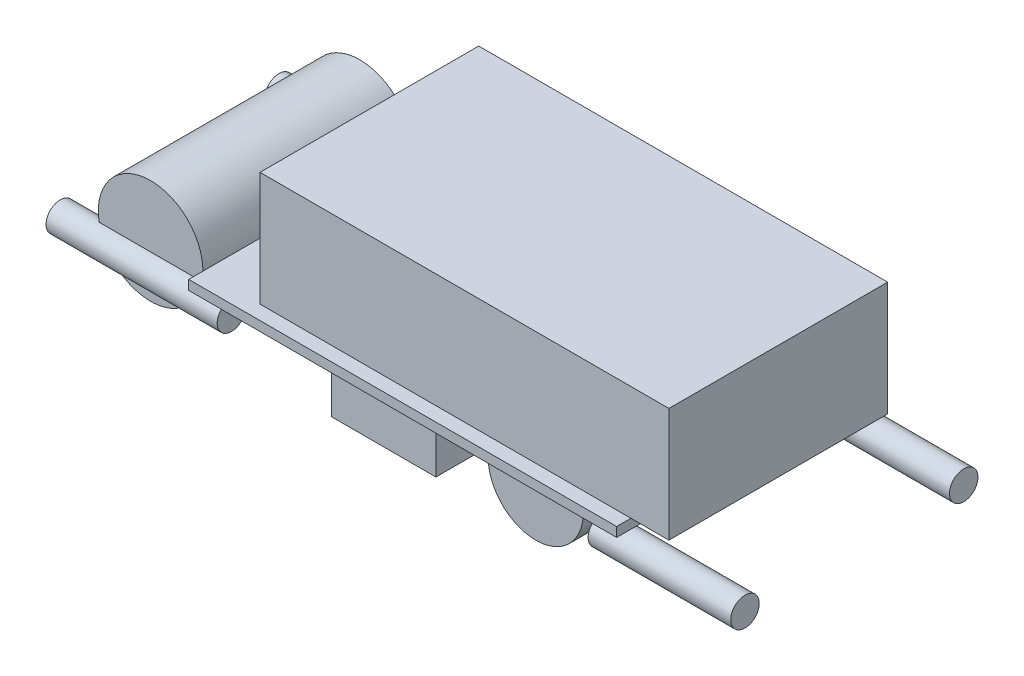
from build123d import *

# Parameters (mm, degrees)
CROQUIS1_W                     = 43
CROQUIS1_H                     = 23
SALIENTE_EXTRUIR1_DEPTH        = 12
CROQUIS2_W                     = 45
CROQUIS2_H                     = 26
SALIENTE_EXTRUIR2_DEPTH        = 1
CROQUIS4_R                     = 5.5
SALIENTE_EXTRUIR3_DEPTH        = 22
SALIENTE_EXTRUIR4_DEPTH        = 5
SALIENTE_EXTRUIR5_START        = -6
CROQUIS7_R                     = 5
SALIENTE_EXTRUIR5_DEPTH        = 13
SALIENTE_EXTRUIR6_DEPTH        = 12
SALIENTE_EXTRUIR6_DEPTH_BACK   = 3
CROQUIS8_R                     = 1.5
SALIENTE_EXTRUIR6_2_DEPTH      = 12
SALIENTE_EXTRUIR6_2_DEPTH_BACK = 3
SALIENTE_EXTRUIR7_DEPTH        = 15
SALIENTE_EXTRUIR7_DEPTH_BACK   = 3
CROQUIS9_R                     = 1.5


with BuildPart() as part:
    # Croquis1 → Saliente-Extruir1 (new body)
    with BuildSketch(Plane(origin=(0, 0, 0), x_dir=(1, 0, 0), z_dir=(0, 1, 0))):
        with Locations((21.5, 11.5)):
            Rectangle(CROQUIS1_W, CROQUIS1_H)
    extrude(amount=SALIENTE_EXTRUIR1_DEPTH)

    # Croquis2 → Saliente-Extruir2 (add)
    with BuildSketch(Plane.XZ):
        with Locations((16.5, -11.5)):
            Rectangle(CROQUIS2_W, CROQUIS2_H)
    extrude(amount=SALIENTE_EXTRUIR2_DEPTH)

    # Croquis6 → Saliente-Extruir4 (add)
    with BuildSketch(Plane.XZ.offset(1)):
        Polygon((8, 0.5), (19, 0.5), (19, -23.5), (5, -23.5), (5, -11.5), (8, -11.5), align=None)
    extrude(amount=SALIENTE_EXTRUIR4_DEPTH)


with BuildPart() as body_2:
    # Croquis4 → Saliente-Extruir3 (new body)
    with BuildSketch(Plane.XY):
        with Locations((-11.5, 0)):
            Circle(CROQUIS4_R)
    extrude(amount=-SALIENTE_EXTRUIR3_DEPTH)

    # Croquis9 → Saliente-Extruir7 (add, two sides: drawn at the far end of the back side and taken through both)
    with BuildSketch(Plane.ZY.offset(6).offset(-SALIENTE_EXTRUIR7_DEPTH_BACK)):
        with Locations(Location((-23, -2.5, 0), (0, 0, 180))):
            Circle(CROQUIS9_R)
        with Locations(Location((0, -2.5, 0), (0, 0, 180))):
            Circle(CROQUIS9_R)
    extrude(amount=SALIENTE_EXTRUIR7_DEPTH + SALIENTE_EXTRUIR7_DEPTH_BACK)


with BuildPart() as body_3:
    # Croquis7 → Saliente-Extruir5 (new body)
    with BuildSketch(Plane(origin=(0, 0, -23), x_dir=(-1, 0, 0), z_dir=(0, 0, -1)).offset(SALIENTE_EXTRUIR5_START)):
        with Locations((-25, -6)):
            Circle(CROQUIS7_R)
    extrude(amount=-SALIENTE_EXTRUIR5_DEPTH)


with BuildPart() as body_4:
    # Croquis8 → Saliente-Extruir6 (new, two sides: drawn at the far end of the back side and taken through both)
    with BuildSketch(Plane(origin=(39, 0, 0), x_dir=(0, 0, -1), z_dir=(1, 0, 0)).offset(-SALIENTE_EXTRUIR6_DEPTH_BACK)):
        with Locations((0, -2.5)):
            Circle(CROQUIS8_R)
    extrude(amount=SALIENTE_EXTRUIR6_DEPTH + SALIENTE_EXTRUIR6_DEPTH_BACK)


with BuildPart() as body_5:
    # Croquis8 → Saliente-Extruir6 2 (new, two sides: drawn at the far end of the back side and taken through both)
    with BuildSketch(Plane(origin=(39, 0, 0), x_dir=(0, 0, -1), z_dir=(1, 0, 0)).offset(-SALIENTE_EXTRUIR6_2_DEPTH_BACK)):
        with Locations((23, -2.5)):
            Circle(CROQUIS8_R)
    extrude(amount=SALIENTE_EXTRUIR6_2_DEPTH + SALIENTE_EXTRUIR6_2_DEPTH_BACK)


solid = Compound([part.part, body_2.part, body_3.part, body_4.part, body_5.part])
